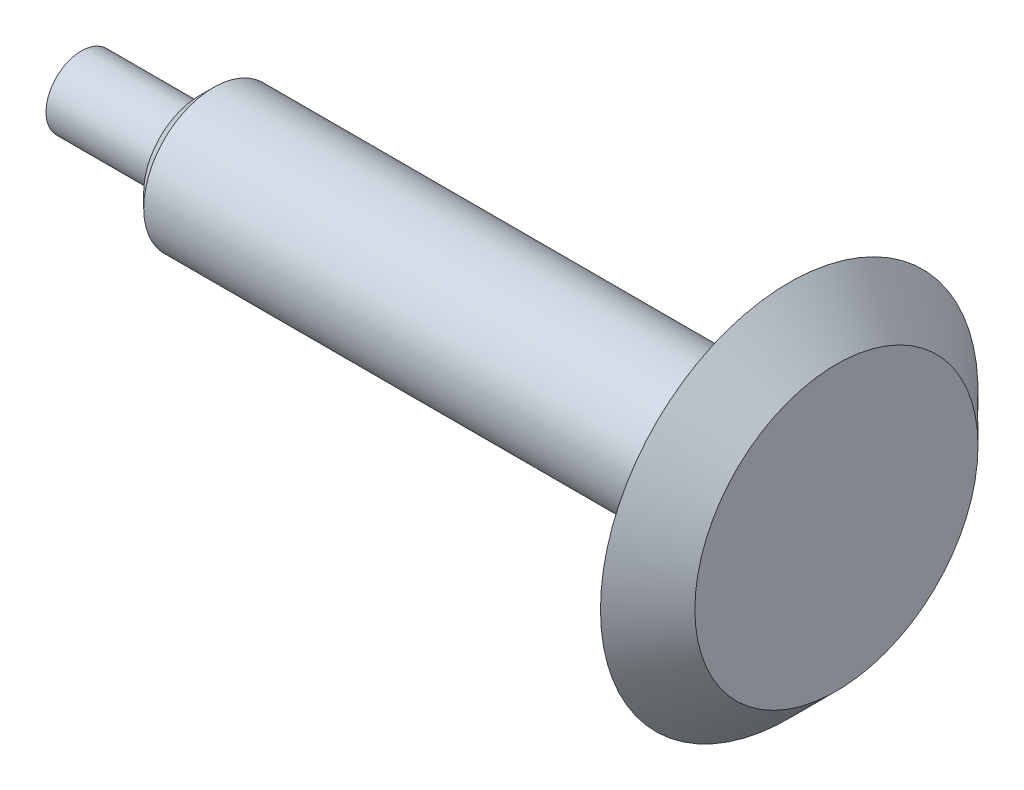
from build123d import *

# Parameters (mm, degrees)
ESQUISSE1_W   = 1120
ESQUISSE1_H   = 147.955968354
ESQUISSE1_W_2 = 250
ESQUISSE1_H_2 = 75


with BuildPart() as part:
    # Esquisse1 → Révolution1 (revolve)
    with BuildSketch(Plane.XY, mode=Mode.PRIVATE) as r_volution1_sk:
        with Locations((473.529943231, -73.977984177)):
            Rectangle(ESQUISSE1_W, ESQUISSE1_H)
        with Locations((-241.470056769, -37.5)):
            Rectangle(ESQUISSE1_W_2, ESQUISSE1_H_2)
        Polygon((-86.470056769, -147.955968354), (-86.470056769, 0), (-116.470056769, 0), (-116.470056769, -75), (-116.470056769, -117.955968354), align=None)
        Polygon((1133.529943231, -247.955968354), (1133.529943231, 0), (1033.529943231, 0), (1033.529943231, -147.955968354), align=None)
        Polygon((1233.529943231, -300), (1233.529943231, 0), (1133.529943231, 0), (1133.529943231, -247.955968354), (1133.529943231, -400), align=None)
    revolve(r_volution1_sk.sketch.rotate(Axis((-576.0190019, 0, 0), (1, 0, 0)), 270), axis=Axis((-576.0190019, 0, 0), (1, 0, 0)))


solid = part.part
